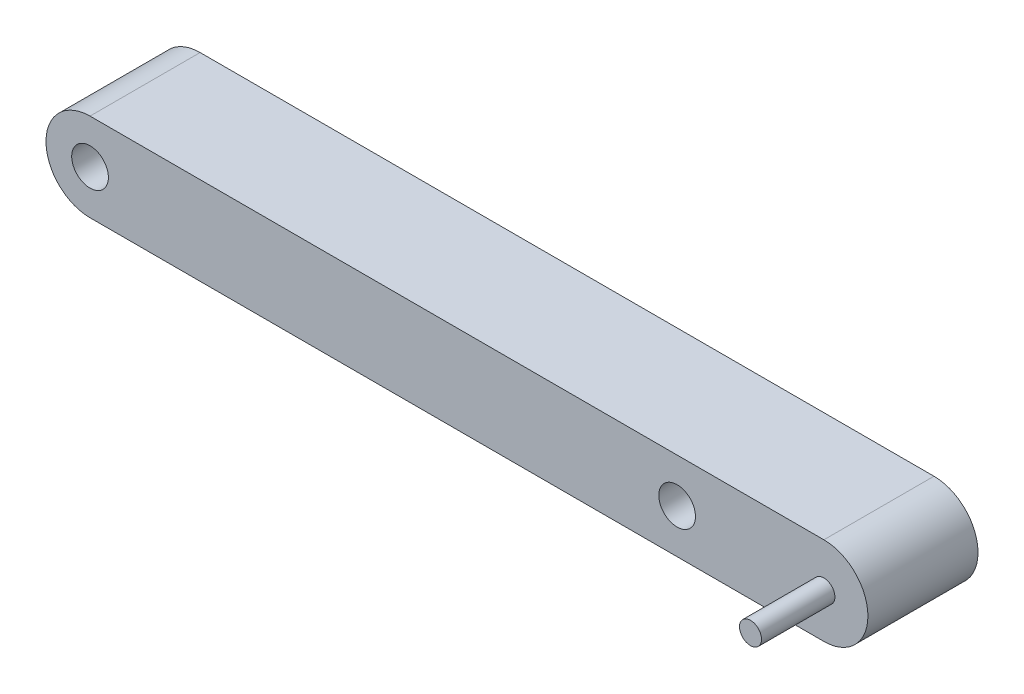
from build123d import *

# Parameters (mm, degrees)
CROQUIS1_R              = 2.5
CROQUIS1_R_2            = 1.5
SALIENTE_EXTRUIR2_DEPTH = 15
CROQUIS1_2_R            = 1.5
SALIENTE_EXTRUIR3_DEPTH = 25


with BuildPart() as part:
    # Croquis1 → Saliente-Extruir2 (new body)
    with BuildSketch(Plane.XY):
        with BuildLine():
            Line((0, 6), (100, 6))
            ThreePointArc((100, 6), (106, 0), (100, -6))
            Line((100, -6), (0, -6))
            ThreePointArc((0, -6), (-6, 0), (0, 6))
        make_face()
        Circle(CROQUIS1_R, mode=Mode.SUBTRACT)
        with Locations((80, 0)):
            Circle(CROQUIS1_R, mode=Mode.SUBTRACT)
        with Locations((100, 0)):
            Circle(CROQUIS1_R_2, mode=Mode.SUBTRACT)
    extrude(amount=SALIENTE_EXTRUIR2_DEPTH)


with BuildPart() as body_2:
    # Croquis1<2> → Saliente-Extruir3 (new body)
    with BuildSketch(Plane.XY):
        with Locations((100, 0)):
            Circle(CROQUIS1_2_R)
    extrude(amount=SALIENTE_EXTRUIR3_DEPTH)


solid = Compound([part.part, body_2.part])
